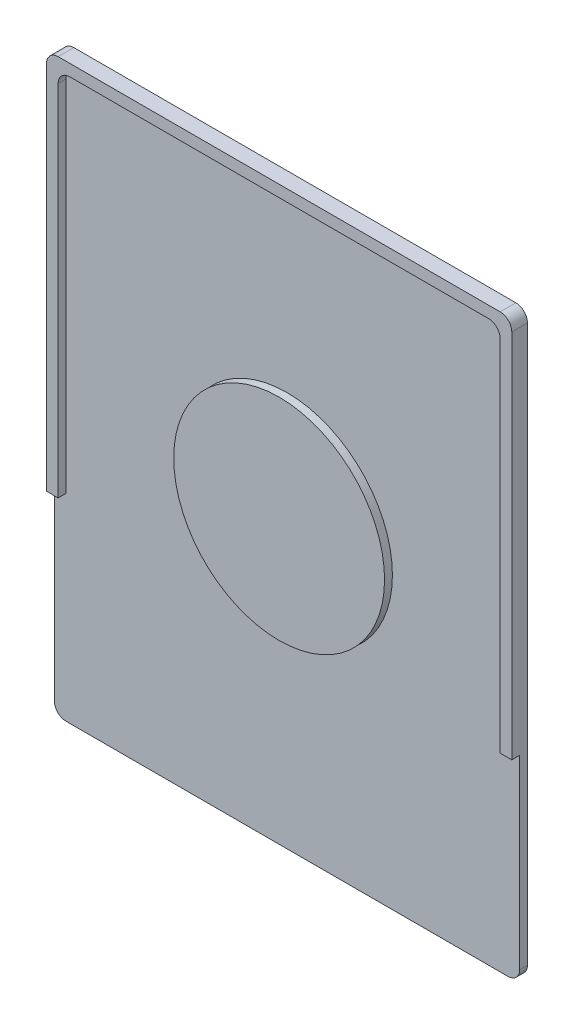
from build123d import *

# Parameters (mm, degrees)
BOSS_EXTRUDE1_DEPTH = 2.7
BOSS_EXTRUDE2_START = 2.7
SKETCH1_4_R         = 36.25
BOSS_EXTRUDE2_DEPTH = 2.7


with BuildPart() as part:
    # Sketch1 → Boss-Extrude1 (new body)
    with BuildSketch(Plane.XY):
        with BuildLine():
            Line((-0.00454753, -3.681705965), (151.99545247, -3.681705965))
            ThreePointArc((151.99545247, -3.681705965), (154.823879594, -2.510133089), (155.99545247, 0.318294035))
            Line((155.99545247, 0.318294035), (155.99545247, 191.602313493))
            ThreePointArc((155.99545247, 191.602313493), (154.823879594, 194.430740617), (151.99545247, 195.602313493))
            Line((151.99545247, 195.602313493), (-0.00454753, 195.602313493))
            ThreePointArc((-0.00454753, 195.602313493), (-2.832974655, 194.430740617), (-4.00454753, 191.602313493))
            Line((-4.00454753, 191.602313493), (-4.00454753, 0.318294035))
            ThreePointArc((-4.00454753, 0.318294035), (-2.832974655, -2.510133089), (-0.00454753, -3.681705965))
        make_face()
    extrude(amount=-BOSS_EXTRUDE1_DEPTH)

    # Sketch1<4> → Boss-Extrude2 (add)
    with BuildSketch(Plane.XY.offset(BOSS_EXTRUDE2_START)):
        with BuildLine():
            Line((-4.00454753, 191.602313493), (-4.00454753, 64.175623566))
            Line((-4.00454753, 64.175623566), (-0.00454753, 64.175623566))
            Line((-0.00454753, 64.175623566), (-0.00454753, 187.602313493))
            ThreePointArc((-0.00454753, 187.602313493), (1.167025345, 190.430740617), (3.99545247, 191.602313493))
            Line((3.99545247, 191.602313493), (147.99545247, 191.602313493))
            ThreePointArc((147.99545247, 191.602313493), (150.823879594, 190.430740617), (151.99545247, 187.602313493))
            Line((151.99545247, 187.602313493), (151.99545247, 64.175623566))
            Line((151.99545247, 64.175623566), (155.99545247, 64.175623566))
            Line((155.99545247, 64.175623566), (155.99545247, 191.602313493))
            ThreePointArc((155.99545247, 191.602313493), (154.823879594, 194.430740617), (151.99545247, 195.602313493))
            Line((151.99545247, 195.602313493), (-0.00454753, 195.602313493))
            ThreePointArc((-0.00454753, 195.602313493), (-2.832974655, 194.430740617), (-4.00454753, 191.602313493))
        make_face()
        with Locations((75.99545247, 95.960303764)):
            Circle(SKETCH1_4_R)
    extrude(amount=-BOSS_EXTRUDE2_DEPTH)


solid = part.part
